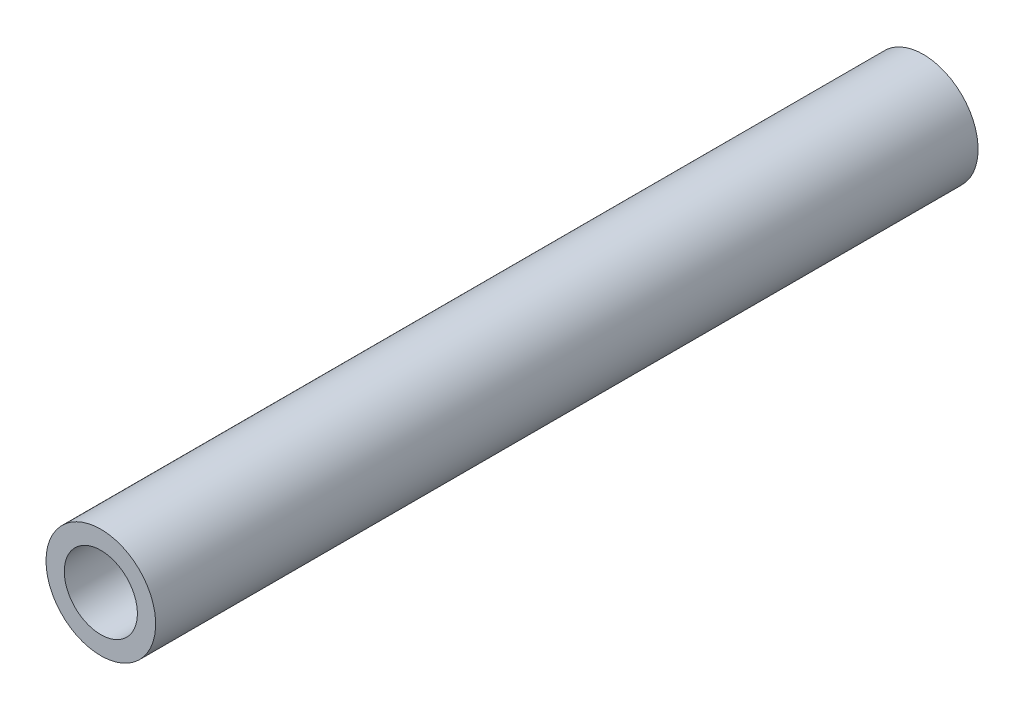
from build123d import *

# Parameters (mm, degrees)
SCHIZZO1_R                   = 3
SCHIZZO1_R_2                 = 2
ESTRUSIONE_ESTRUSIONE1_DEPTH = 45


with BuildPart() as part:
    # Schizzo1 → Estrusione-Estrusione1 (new body)
    with BuildSketch(Plane.XY):
        with Locations(Location((70, -82.5, 0), (0, 0, 180))):
            Circle(SCHIZZO1_R)
        with Locations(Location((70, -82.5, 0), (0, 0, 180))):
            Circle(SCHIZZO1_R_2, mode=Mode.SUBTRACT)
    extrude(amount=ESTRUSIONE_ESTRUSIONE1_DEPTH)


solid = part.part
